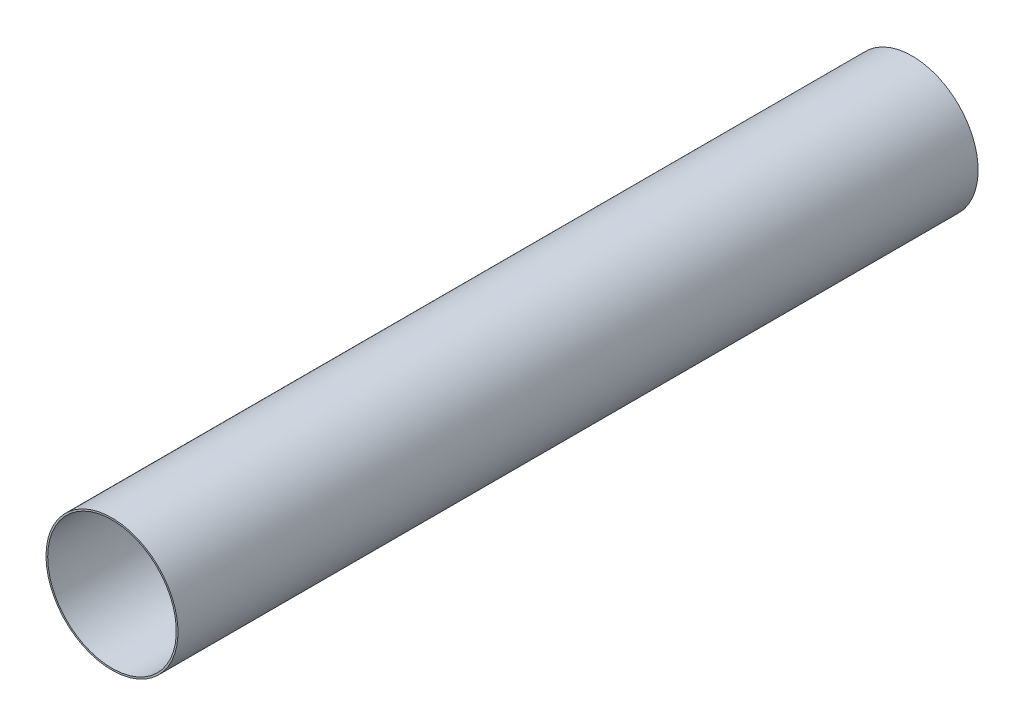
from build123d import *

# Parameters (mm, degrees)
SKETCH1_R           = 78.35
SKETCH1_R_2         = 76.35
BOSS_EXTRUDE1_DEPTH = 950


with BuildPart() as part:
    # Sketch1 → Boss-Extrude1 (new body)
    with BuildSketch(Plane.XY):
        with Locations(Location((0, 0, 0), (0, 0, 180))):
            Circle(SKETCH1_R)
        with Locations(Location((0, 0, 0), (0, 0, 180))):
            Circle(SKETCH1_R_2, mode=Mode.SUBTRACT)
    extrude(amount=BOSS_EXTRUDE1_DEPTH)


solid = part.part
